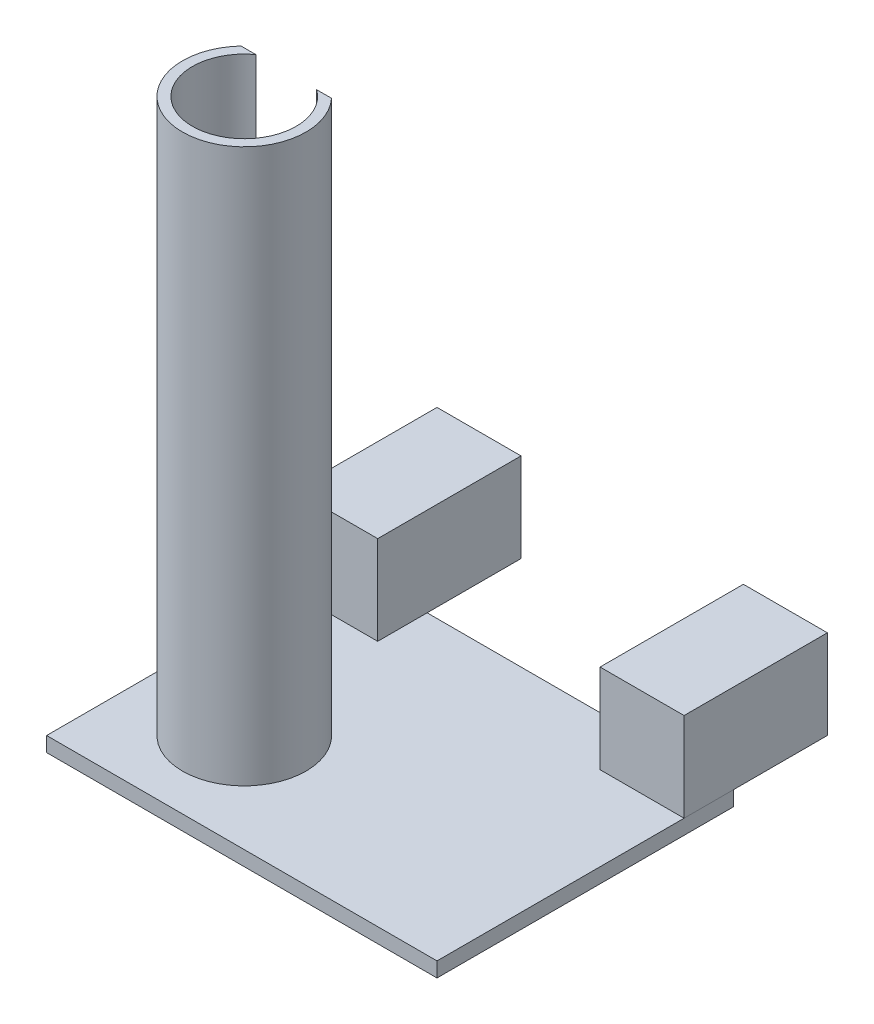
from build123d import *

# Parameters (mm, degrees)
SKETCH1_W           = 79
SKETCH1_H           = 60
BOSS_EXTRUDE1_DEPTH = 3
SKETCH2_W           = 17
SKETCH2_H           = 29
BOSS_EXTRUDE2_DEPTH = 18
SKETCH3_W           = 14
SKETCH3_H           = 14
CUT_EXTRUDE1_DEPTH  = 16
SKETCH5_R           = 12.5
BOSS_EXTRUDE3_DEPTH = 112
SKETCH7_W           = 40
SKETCH7_H           = 11.5
CUT_EXTRUDE2_DEPTH  = 112
SKETCH8_R           = 10.5
CUT_EXTRUDE3_DEPTH  = 112


with BuildPart() as part:
    # Sketch1 → Boss-Extrude1 (new body)
    with BuildSketch(Plane(origin=(0, 0, 0), x_dir=(1, 0, 0), z_dir=(0, 1, 0))):
        Rectangle(SKETCH1_W, SKETCH1_H)
    extrude(amount=BOSS_EXTRUDE1_DEPTH)

    # Sketch5 → Boss-Extrude3 (add)
    with BuildSketch(Plane(origin=(0, 3, 0), x_dir=(1, 0, 0), z_dir=(0, 1, 0))):
        with Locations(Location((-19.5, -10, 0), (0, 0, 90))):
            Circle(SKETCH5_R)
    extrude(amount=BOSS_EXTRUDE3_DEPTH)

    # Sketch7 → Cut-Extrude2 (cut)
    with BuildSketch(Plane(origin=(0, 3, 0), x_dir=(1, 0, 0), z_dir=(0, 1, 0))):
        with Locations((-19.5, 4.25)):
            Rectangle(SKETCH7_W, SKETCH7_H)
    extrude(amount=CUT_EXTRUDE2_DEPTH, mode=Mode.SUBTRACT)

    # Sketch8 → Cut-Extrude3 (cut)
    with BuildSketch(Plane(origin=(0, 3, 0), x_dir=(1, 0, 0), z_dir=(0, 1, 0))):
        with Locations((-19.5, -10)):
            Circle(SKETCH8_R)
    extrude(amount=CUT_EXTRUDE3_DEPTH, mode=Mode.SUBTRACT)


with BuildPart() as body_2:
    # Sketch2 → Boss-Extrude2 (new body)
    with BuildSketch(Plane(origin=(0, 3, 0), x_dir=(1, 0, 0), z_dir=(0, 1, 0))):
        with Locations((-31, 34.5)):
            Rectangle(SKETCH2_W, SKETCH2_H)
    extrude(amount=BOSS_EXTRUDE2_DEPTH)

    # Sketch3 → Cut-Extrude1 (cut)
    with BuildSketch(Plane.XZ.offset(-3)):
        with Locations((-31, -39.5)):
            Rectangle(SKETCH3_W, SKETCH3_H)
    extrude(amount=-CUT_EXTRUDE1_DEPTH, mode=Mode.SUBTRACT)


with BuildPart() as body_3:
    # Mirror1: mirrored copy
    add(body_2.part.mirror(Plane(origin=(0, 0, 0), x_dir=(0, 0, 1), z_dir=(1, 0, 0))))


solid = Compound([part.part, body_2.part, body_3.part])
